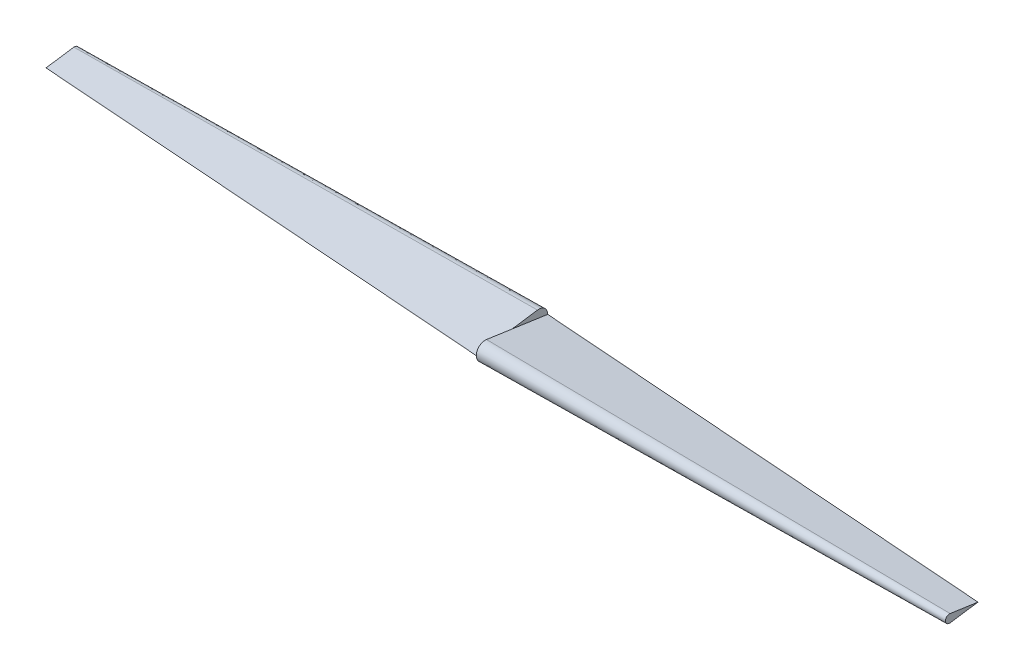
from build123d import *

# Parameters (mm, degrees)
BOSS_EXTRUDE1_DEPTH = 660.4
BOSS_EXTRUDE1_TAPER = 0.6
CIRPATTERN1_COUNT   = 2


with BuildPart() as part:
    # Sketch1 → Boss-Extrude1 (new body)
    with BuildSketch(Plane(origin=(0, 0, 0), x_dir=(0, 0, -1), z_dir=(1, 0, 0))):
        with BuildLine():
            Line((50.8, 0), (-36.285714286, 12.569740146))
            ThreePointArc((-36.285714286, 12.569740146), (-50.8, 0), (-36.285714286, -12.569740146))
            Line((-36.285714286, -12.569740146), (50.8, 0))
        make_face()
    boss_extrude1 = extrude(amount=BOSS_EXTRUDE1_DEPTH, taper=BOSS_EXTRUDE1_TAPER)

    # CirPattern1: Boss-Extrude1 ×2 about axis
    cirpattern1_axis = Axis((0, 0, 0), (0, 1, 0))
    for i in range(1, CIRPATTERN1_COUNT):
        add(boss_extrude1.rotate(cirpattern1_axis, i * 360 / CIRPATTERN1_COUNT))


solid = part.part
